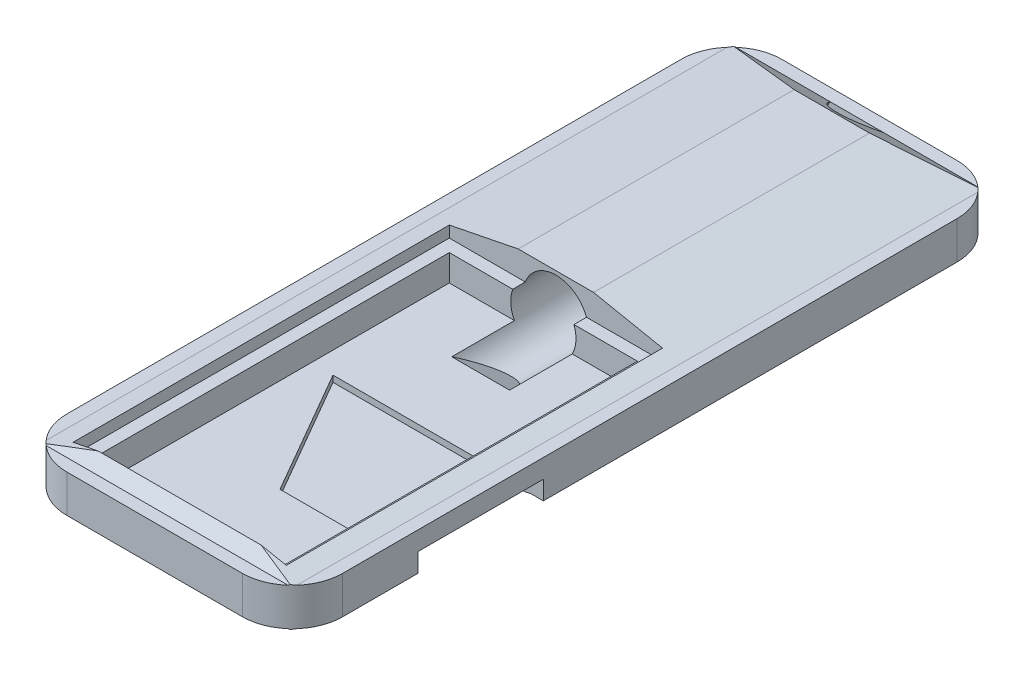
from build123d import *

# Parameters (mm, degrees)
EXTRUDE_1_DEPTH          = 28.5
FILLET_3_R               = 4
CUT_EXTRUDE_1_DEPTH      = 31.686479107
CUT_EXTRUDE_1_DEPTH_BACK = 31.686479107
SKETCH_4_W               = 15
SKETCH_4_H               = 29
CUT_EXTRUDE_5_DEPTH      = 1.2
CUT_EXTRUDE_6_DEPTH      = 5
CUT_EXTRUDE_6_DEPTH_BACK = 25
SKETCH_5_R               = 2.6
CUT_EXTRUDE_7_DEPTH      = 31.823043328
DRAFT_1_ANGLE            = 60
SKETCH_7_W               = 10
SKETCH_7_H               = 1.2
SKETCH_7_H_2             = 0.5
CUT_EXTRUDE_8_DEPTH      = 31.686479107
DRAFT_3_ANGLE            = 30
SKETCH_8_W               = 17
SKETCH_8_H               = 30
CUT_EXTRUDE_9_DEPTH      = 2


with BuildPart() as part:
    # Эскиз2 → Бобышка-Вытянуть1 (new, symmetric)
    with BuildSketch(Plane.XY):
        Polygon((-10, 1.5), (-3, 2.9), (0, 2.9), (3, 2.9), (10, 1.5), (11, 1.5), (11, -1.5), (10, -1.5), (3, -2.9), (0, -2.9), (-3, -2.9), (-10, -1.5), (-11, -1.5), (-11, 1.5), align=None)
    extrude(amount=EXTRUDE_1_DEPTH, both=True)

    # Скругление3
    fillet_3_edges = [part.edges().sort_by_distance(p)[0] for p in [
        (-11, 0, -28.5),
        (-11, 0, 28.5),
        (11, 0, 28.5),
        (11, 0, -28.5),
    ]]
    fillet(fillet_3_edges, radius=FILLET_3_R)

    # Эскиз3 → Вырез-Вытянуть1 (cut, two sides: drawn at the far end of the back side and taken through both)
    with BuildSketch(Plane(origin=(0, 0, 0), x_dir=(0, 0, -1), z_dir=(1, 0, 0)).offset(-CUT_EXTRUDE_1_DEPTH_BACK)):
        Polygon((28.5, 2.9), (25.5, 2.9), (27.5, 1.5), (28.5, 1.5), align=None)
        Polygon((-27.5, -1.5), (-28.5, -1.5), (-28.5, -2.9), (-25.5, -2.9), align=None)
        Polygon((-25.5, 2.9), (-28.5, 2.9), (-28.5, 1.5), (-27.5, 1.5), align=None)
        Polygon((25.5, -2.9), (28.5, -2.9), (28.5, -1.5), (27.5, -1.5), align=None)
    extrude(amount=CUT_EXTRUDE_1_DEPTH + CUT_EXTRUDE_1_DEPTH_BACK, mode=Mode.SUBTRACT)

    # Эскиз4 → Вырез-Вытянуть5 (cut, symmetric)
    with BuildSketch(Plane(origin=(0, 0, 0), x_dir=(1, 0, 0), z_dir=(0, 1, 0))):
        with Locations((0, -12)):
            Rectangle(SKETCH_4_W, SKETCH_4_H)
    extrude(amount=CUT_EXTRUDE_5_DEPTH, both=True, mode=Mode.SUBTRACT)

    # Эскиз5 → Вырез-Вытянуть6 (cut, two sides: drawn at the far end of the back side and taken through both)
    with BuildSketch(Plane.XY.offset(-2.5).offset(-CUT_EXTRUDE_6_DEPTH_BACK)):
        with Locations(Location((0, 0, 0), (0, 0, 152.51357375))):
            Circle(SKETCH_5_R)
    extrude(amount=CUT_EXTRUDE_6_DEPTH + CUT_EXTRUDE_6_DEPTH_BACK, mode=Mode.SUBTRACT)

    # Эскиз6 → Вырез-Вытянуть7 (cut, through all)
    with BuildSketch(Plane.XZ.offset(-1.2)):
        Polygon((-2.306512519, -2.5), (2.306512519, -2.5), (7.5, -2.5), (7.5, 26.5), (-7.5, 26.5), (-7.5, -2.5), align=None)
    extrude(amount=-CUT_EXTRUDE_7_DEPTH, mode=Mode.SUBTRACT)

    # Уклон1
    draft_1_faces = [part.faces().sort_by_distance(p)[0] for p in [
        (0, -1.775343229, 2.5),
    ]]
    draft(draft_1_faces, Plane.ZX.offset(-1.2), DRAFT_1_ANGLE)

    # Эскиз7 → Вырез-Вытянуть8 (cut, through all)
    with BuildSketch(Plane(origin=(0, 0, 0), x_dir=(0, 0, -1), z_dir=(1, 0, 0))):
        with Locations((-13.5, -0.6)):
            Rectangle(SKETCH_7_W, SKETCH_7_H)
        with Locations((-13.5, -1.45)):
            Rectangle(SKETCH_7_W, SKETCH_7_H_2)
    extrude(amount=CUT_EXTRUDE_8_DEPTH, mode=Mode.SUBTRACT)

    # Уклон3
    draft_3_faces = [part.faces().sort_by_distance(p)[0] for p in [
        (0, -1.45, 13.5),
    ]]
    draft(draft_3_faces, Plane(origin=(11, 0, 18.5), x_dir=(-1, 0, 0), z_dir=(0, 0, -1)), DRAFT_3_ANGLE)

    # Эскиз8 → Вырез-Вытянуть9 (cut)
    with BuildSketch(Plane(origin=(0, 2.9, 0), x_dir=(1, 0, 0), z_dir=(0, 1, 0))):
        with Locations((0, -11.5)):
            Rectangle(SKETCH_8_W, SKETCH_8_H)
    extrude(amount=-CUT_EXTRUDE_9_DEPTH, mode=Mode.SUBTRACT)


solid = part.part
